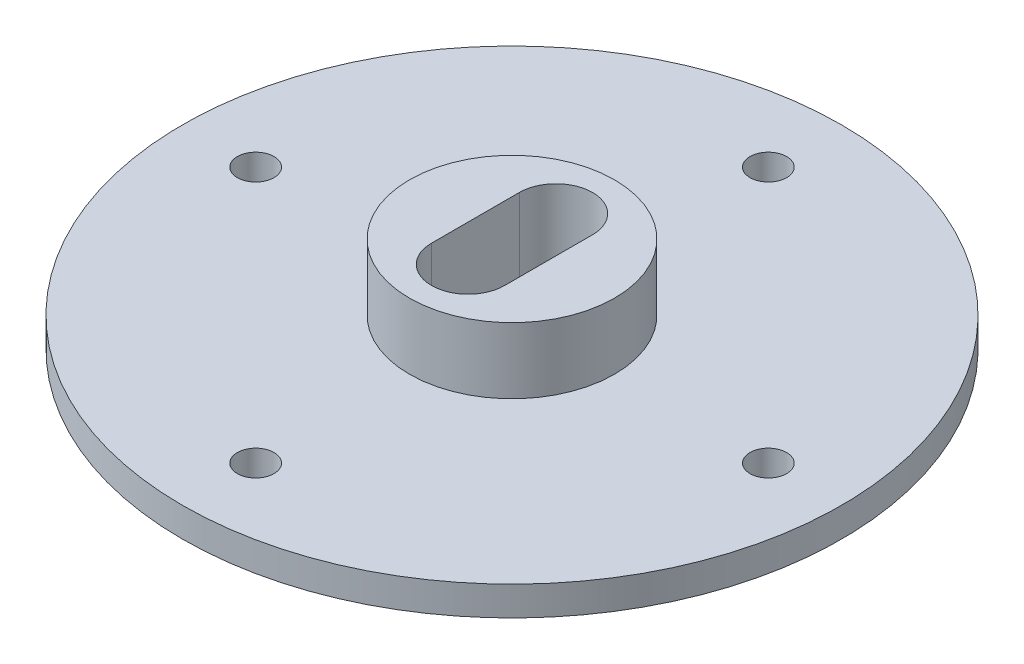
from build123d import *

# Parameters (mm, degrees)
SKETCH1_R           = 45
SKETCH1_R_2         = 2.5
BOSS_EXTRUDE1_DEPTH = 4
SKETCH1_3_R         = 14
BOSS_EXTRUDE2_DEPTH = 13
CUT_EXTRUDE1_DEPTH  = 65.953829756


with BuildPart() as part:
    # Sketch1 → Boss-Extrude1 (new body)
    with BuildSketch(Plane(origin=(0, 0, 0), x_dir=(1, 0, 0), z_dir=(0, 1, 0))):
        Circle(SKETCH1_R)
        with Locations((-35, 0)):
            Circle(SKETCH1_R_2, mode=Mode.SUBTRACT)
        with Locations((0, -35)):
            Circle(SKETCH1_R_2, mode=Mode.SUBTRACT)
        with Locations((35, 0)):
            Circle(SKETCH1_R_2, mode=Mode.SUBTRACT)
        with Locations((0, 35)):
            Circle(SKETCH1_R_2, mode=Mode.SUBTRACT)
    extrude(amount=BOSS_EXTRUDE1_DEPTH)

    # Sketch1<3> → Boss-Extrude2 (add)
    with BuildSketch(Plane(origin=(0, 0, 0), x_dir=(1, 0, 0), z_dir=(0, 1, 0))):
        Circle(SKETCH1_3_R)
    extrude(amount=BOSS_EXTRUDE2_DEPTH)

    # Sketch3 → Cut-Extrude1 (cut, through all)
    with BuildSketch(Plane(origin=(0, 13, 0), x_dir=(1, 0, 0), z_dir=(0, 1, 0))):
        with BuildLine():
            Line((-5, -6), (-5, 6))
            ThreePointArc((-5, 6), (0, 11), (5, 6))
            Line((5, 6), (5, -6))
            ThreePointArc((5, -6), (0, -11), (-5, -6))
        make_face()
    extrude(amount=-CUT_EXTRUDE1_DEPTH, mode=Mode.SUBTRACT)


solid = part.part
